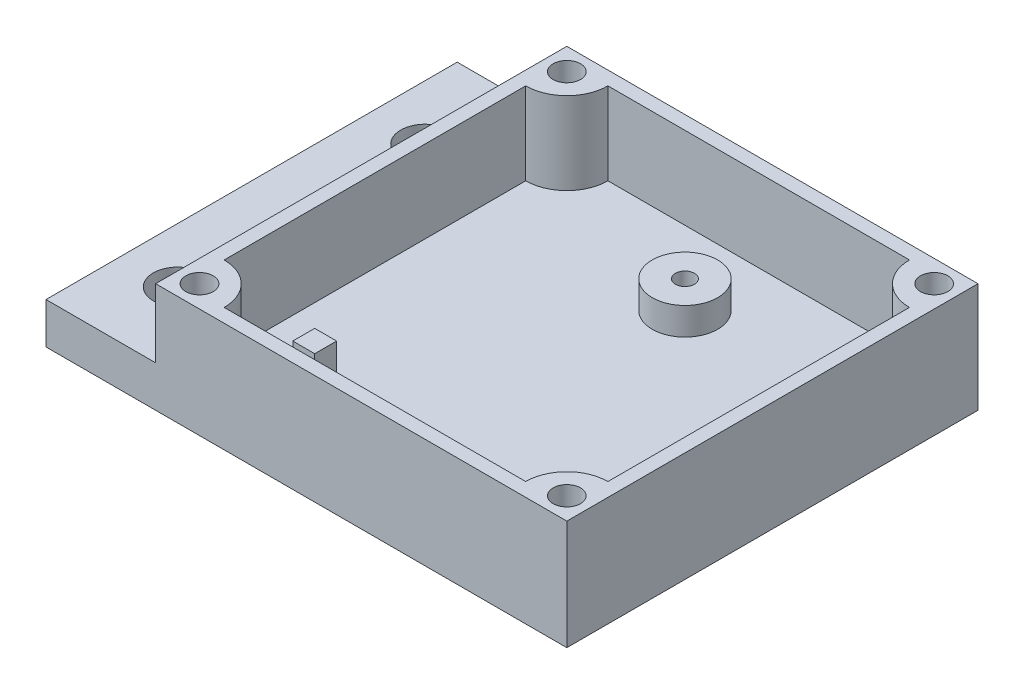
from build123d import *

# Parameters (mm, degrees)
SKETCH1_W           = 38.1
SKETCH1_H           = 38.1
BOSS_EXTRUDE1_DEPTH = 2.54
SKETCH2_W           = 38.1
SKETCH2_H           = 38.1
SKETCH2_R           = 1.27
BOSS_EXTRUDE2_DEPTH = 7.62
SKETCH4_R           = 3.030246623
SKETCH4_R_2         = 0.88307969
SKETCH4_W           = 2.032
SKETCH4_H           = 2.032
BOSS_EXTRUDE3_DEPTH = 2.54
SKETCH7_W           = 10.16
SKETCH7_H           = 38.1
SKETCH7_R           = 2.2479
BOSS_EXTRUDE5_DEPTH = 3.81


with BuildPart() as part:
    # Sketch1 → Boss-Extrude1 (new body)
    with BuildSketch(Plane(origin=(0, 0, 0), x_dir=(1, 0, 0), z_dir=(0, 1, 0))):
        Rectangle(SKETCH1_W, SKETCH1_H)
    extrude(amount=BOSS_EXTRUDE1_DEPTH)

    # Sketch2 → Boss-Extrude2 (add)
    # profile 1 of 2: a face of its own
    with BuildSketch(Plane(origin=(0, 2.54, 0), x_dir=(1, 0, 0), z_dir=(0, 1, 0))):
        Rectangle(SKETCH2_W, SKETCH2_H)
        with Locations(Location((-17.018, -17.018, 0), (0, 0, 90))):
            Circle(SKETCH2_R, mode=Mode.SUBTRACT)
        with Locations(Location((17.018, -17.018, 0), (0, 0, 90))):
            Circle(SKETCH2_R, mode=Mode.SUBTRACT)
        with BuildLine():
            Line((14.940193669, 15.24), (15.24, 15.24))
            Line((15.24, 15.24), (15.24, 14.940193669))
            ThreePointArc((15.24, 14.940193669), (16.420507838, 14.220803312), (17.78, 13.97))
            Line((17.78, 13.97), (17.78, -13.97))
            ThreePointArc((17.78, -13.97), (15.085923164, -15.085923164), (13.97, -17.78))
            Line((13.97, -17.78), (-13.97, -17.78))
            ThreePointArc((-13.97, -17.78), (-15.085923164, -15.085923164), (-17.78, -13.97))
            Line((-17.78, -13.97), (-17.78, 13.97))
            ThreePointArc((-17.78, 13.97), (-15.085923164, 15.085923164), (-13.97, 17.78))
            Line((-13.97, 17.78), (13.97, 17.78))
            ThreePointArc((13.97, 17.78), (14.220803312, 16.420507838), (14.940193669, 15.24))
        make_face(mode=Mode.SUBTRACT)
        with Locations(Location((-17.018, 17.018, 0), (0, 0, 90))):
            Circle(SKETCH2_R, mode=Mode.SUBTRACT)
        with Locations(Location((17.018, 17.018, 0), (0, 0, 90))):
            Circle(SKETCH2_R, mode=Mode.SUBTRACT)
    # profile 2 of 2: a face of its own
    with BuildSketch(Plane(origin=(0, 2.54, 0), x_dir=(1, 0, 0), z_dir=(0, 1, 0))):
        with BuildLine():
            Line((15.24, 14.940193669), (15.24, 15.24))
            Line((15.24, 15.24), (14.940193669, 15.24))
            ThreePointArc((14.940193669, 15.24), (15.085923164, 15.085923164), (15.24, 14.940193669))
        make_face()
    extrude(amount=BOSS_EXTRUDE2_DEPTH)

    # Sketch4 → Boss-Extrude3 (add)
    # profile 1 of 3: a face of its own
    with BuildSketch(Plane(origin=(0, 2.54, 0), x_dir=(1, 0, 0), z_dir=(0, 1, 0))):
        with Locations(Location((0, 10.947233516, 0), (0, 0, 270))):
            Circle(SKETCH4_R)
        with Locations(Location((0, 10.947233516, 0), (0, 0, 270))):
            Circle(SKETCH4_R_2, mode=Mode.SUBTRACT)
    # profile 2 of 3: a face of its own
    with BuildSketch(Plane(origin=(0, 2.54, 0), x_dir=(1, 0, 0), z_dir=(0, 1, 0))):
        with Locations((-12.16137027, -11.201233516)):
            Rectangle(SKETCH4_W, SKETCH4_H)
    # profile 3 of 3: a face of its own
    with BuildSketch(Plane(origin=(0, 2.54, 0), x_dir=(1, 0, 0), z_dir=(0, 1, 0))):
        with Locations((11.557, -11.201233516)):
            Rectangle(SKETCH4_W, SKETCH4_H)
    extrude(amount=BOSS_EXTRUDE3_DEPTH)

    # Sketch7 → Boss-Extrude5 (add)
    with BuildSketch(Plane.XZ):
        with Locations((-24.13, 0)):
            Rectangle(SKETCH7_W, SKETCH7_H)
        with Locations(Location((-24.13, -10.990632384, 0), (0, 0, 270))):
            Circle(SKETCH7_R, mode=Mode.SUBTRACT)
        with Locations(Location((-24.13, 11.937008295, 0), (0, 0, 270))):
            Circle(SKETCH7_R, mode=Mode.SUBTRACT)
    extrude(amount=-BOSS_EXTRUDE5_DEPTH)


solid = part.part
